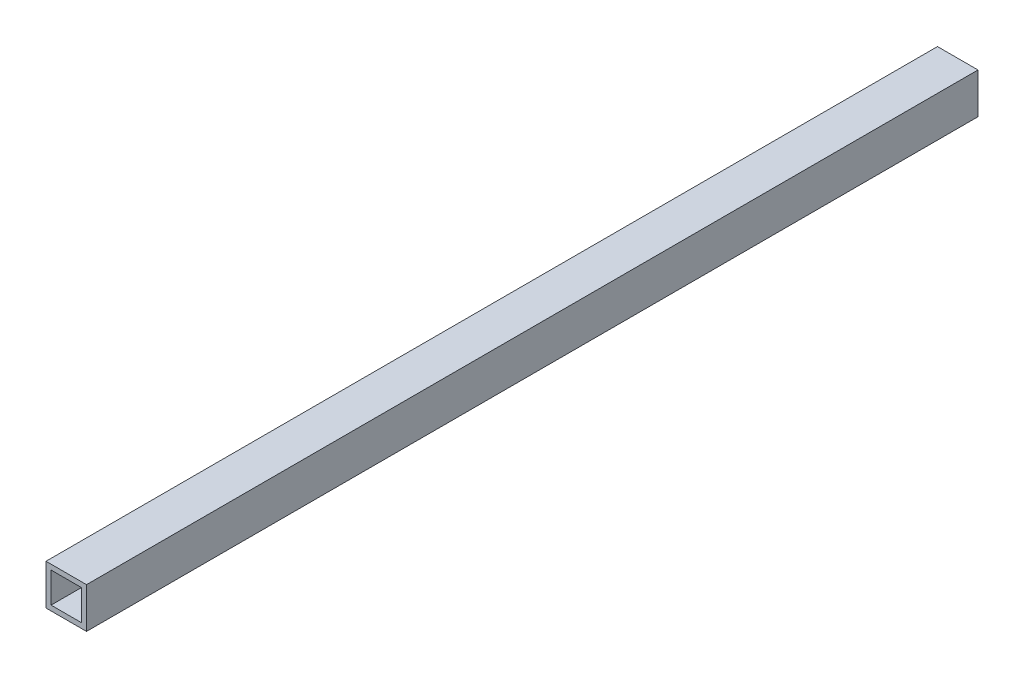
from build123d import *

# Parameters (mm, degrees)
SKETCH1_W           = 25.4
SKETCH1_H           = 25.4
SKETCH1_W_2         = 19.05
SKETCH1_H_2         = 19.05
BOSS_EXTRUDE1_DEPTH = 558.8


with BuildPart() as part:
    # Sketch1 → Boss-Extrude1 (new body)
    with BuildSketch(Plane.XY):
        Rectangle(SKETCH1_W, SKETCH1_H)
        Rectangle(SKETCH1_W_2, SKETCH1_H_2, mode=Mode.SUBTRACT)
    extrude(amount=BOSS_EXTRUDE1_DEPTH)


solid = part.part
